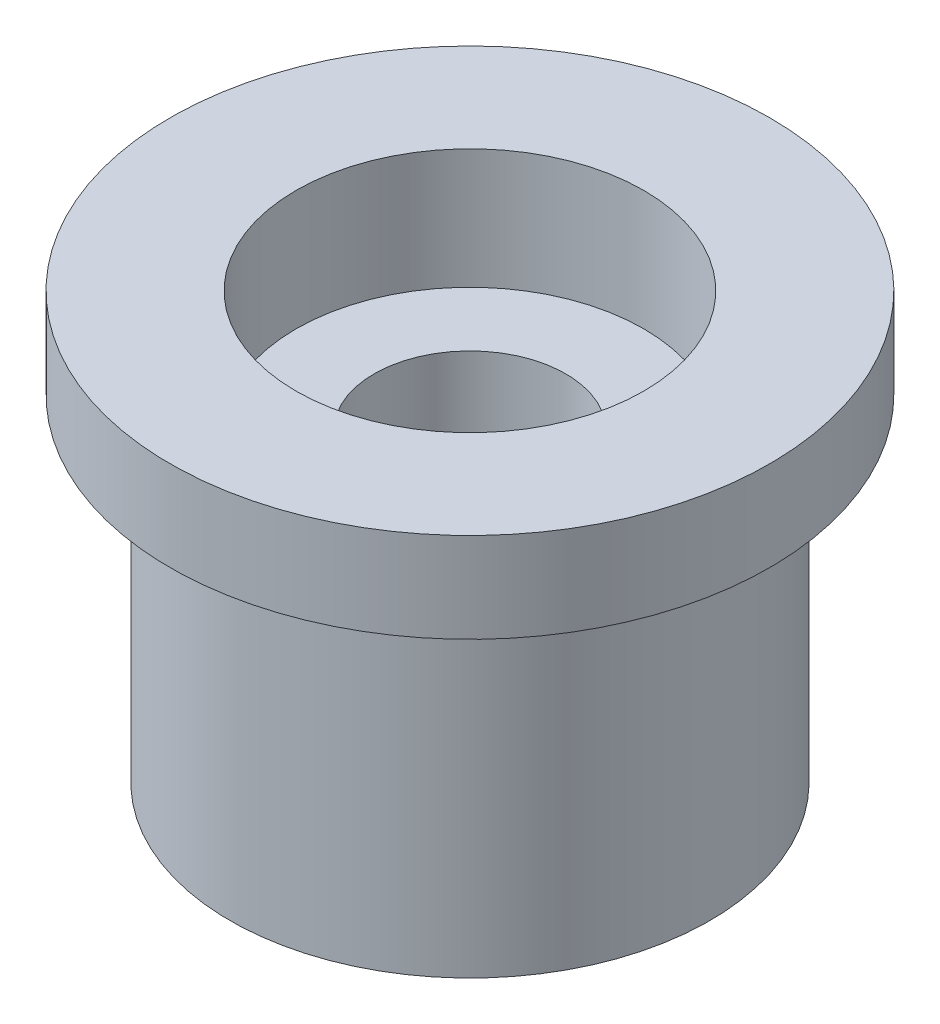
from build123d import *

# Parameters (mm, degrees)
SKETCH_1_W                   = 5
SKETCH_1_H                   = 1.5
SKETCH_2_R                   = 4
EXTRUDE_1_DEPTH              = 5.6
CUT_EXTRUDE_1_DEPTH          = 4.3
CUT_EXTRUDE_2_DEPTH          = 4.3
CUT_EXTRUDE_3_DEPTH          = 4.3
HOLE_WIZARD_M3_1_D           = 3.2
HOLE_WIZARD_M3_1_CBORE_D     = 5.8
HOLE_WIZARD_M3_1_CBORE_DEPTH = 2


with BuildPart() as part:
    # 草图1 → 旋转1 (revolve)
    with BuildSketch(Plane.XY, mode=Mode.PRIVATE) as revolve_1_sk:
        with Locations((2.5, 6.35)):
            Rectangle(SKETCH_1_W, SKETCH_1_H)
    revolve(revolve_1_sk.sketch.rotate(Axis((0, 7.1, 0), (0, -1, 0)), 270), axis=Axis((0, 7.1, 0), (0, -1, 0)))

    # 草图2 → 凸台-拉伸1 (add)
    with BuildSketch(Plane.XZ.offset(-5.6)):
        with Locations(Location((0, 0, 0), (0, 0, 270))):
            Circle(SKETCH_2_R)
    extrude(amount=EXTRUDE_1_DEPTH)

    # 草图3 → 切除-拉伸1 (cut)
    with BuildSketch(Plane.XZ):
        with BuildLine():
            Line((-1.478885327, 1.761504525), (-1.883452776, 2.462235902))
            ThreePointArc((-1.883452776, 2.462235902), (-3.1, -9e-09), (-1.883452762, -2.462235914))
            Line((-1.883452762, -2.462235914), (-1.478885327, -1.761504525))
            ThreePointArc((-1.478885327, -1.761504525), (-2.3, 0), (-1.478885327, 1.761504525))
        make_face()
    extrude(amount=-CUT_EXTRUDE_1_DEPTH, mode=Mode.SUBTRACT)

    # 草图4 → 切除-拉伸2 (cut)
    with BuildSketch(Plane.XZ):
        with BuildLine():
            Line((3.07408523, -0.4), (2.264950331, -0.4))
            ThreePointArc((2.264950331, -0.4), (1.15, -1.991858429), (-0.786065004, -2.161504525))
            Line((-0.786065004, -2.161504525), (-1.190632453, -2.862235902))
            ThreePointArc((-1.190632453, -2.862235902), (1.55, -2.684678752), (3.07408523, -0.4))
        make_face()
    extrude(amount=-CUT_EXTRUDE_2_DEPTH, mode=Mode.SUBTRACT)

    # 草图5 → 切除-拉伸3 (cut)
    with BuildSketch(Plane.XZ):
        with BuildLine():
            Line((2.264950331, 0.4), (3.07408523, 0.4))
            ThreePointArc((3.07408523, 0.4), (1.55, 2.684678752), (-1.190632453, 2.862235902))
            Line((-1.190632453, 2.862235902), (-0.786065004, 2.161504525))
            ThreePointArc((-0.786065004, 2.161504525), (1.15, 1.991858429), (2.264950331, 0.4))
        make_face()
    extrude(amount=-CUT_EXTRUDE_3_DEPTH, mode=Mode.SUBTRACT)

    # M3 六角头机械螺钉的柱形沉头孔1 (through all)
    with Locations(Plane(origin=(0, 7.1, 0), x_dir=(1, 0, 0), z_dir=(0, 1, 0))):
        with Locations((0, 0)):
            CounterBoreHole(HOLE_WIZARD_M3_1_D / 2, HOLE_WIZARD_M3_1_CBORE_D / 2, HOLE_WIZARD_M3_1_CBORE_DEPTH)


solid = part.part
